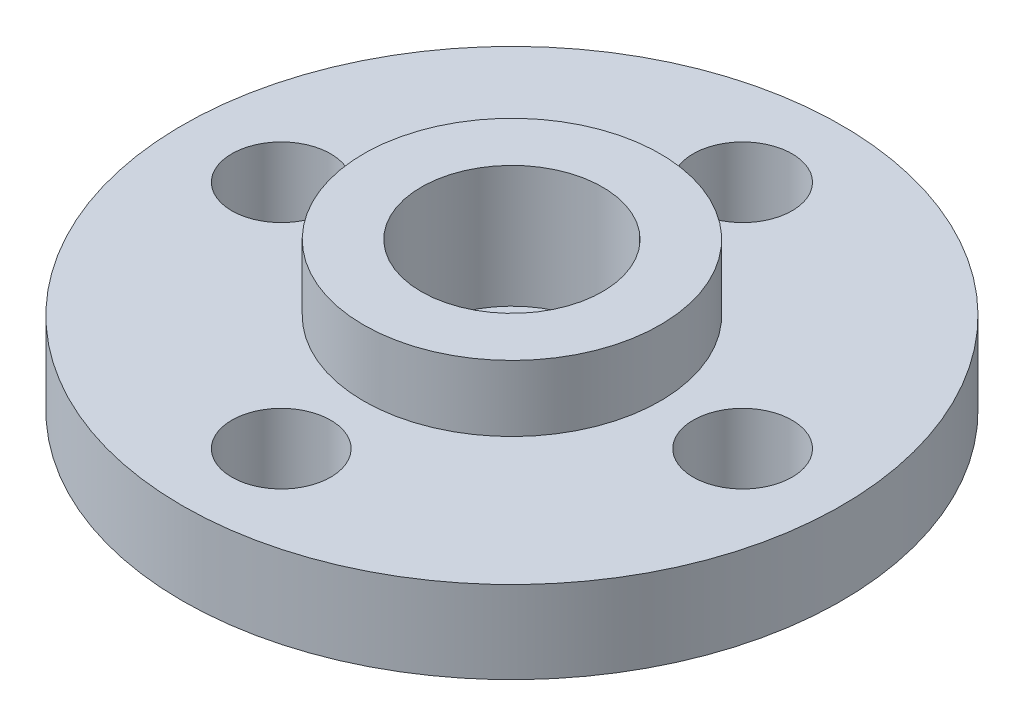
from build123d import *

# Parameters (mm, degrees)
SKETCH1_R           = 10
SKETCH1_R_2         = 1.5
BOSS_EXTRUDE1_DEPTH = 2.5
SKETCH2_R           = 4.5
SKETCH2_R_2         = 1.5
BOSS_EXTRUDE2_DEPTH = 2
SKETCH3_R           = 2.75
CUT_EXTRUDE1_DEPTH  = 3.7


with BuildPart() as part:
    # Sketch1 → Boss-Extrude1 (new body)
    with BuildSketch(Plane(origin=(0, 0, 0), x_dir=(1, 0, 0), z_dir=(0, 1, 0))):
        with Locations(Location((0, 0, 0), (0, 0, 270))):
            Circle(SKETCH1_R)
        with Locations(Location((0, 7, 0), (0, 0, 270))):
            Circle(SKETCH1_R_2, mode=Mode.SUBTRACT)
        with Locations(Location((7, 0, 0), (0, 0, 270))):
            Circle(SKETCH1_R_2, mode=Mode.SUBTRACT)
        with Locations(Location((0, -7, 0), (0, 0, 270))):
            Circle(SKETCH1_R_2, mode=Mode.SUBTRACT)
        with Locations(Location((-7, 0, 0), (0, 0, 270))):
            Circle(SKETCH1_R_2, mode=Mode.SUBTRACT)
        with Locations(Location((0, 0, 0), (0, 0, 270))):
            Circle(SKETCH1_R_2, mode=Mode.SUBTRACT)
    extrude(amount=BOSS_EXTRUDE1_DEPTH)

    # Sketch2 → Boss-Extrude2 (add)
    with BuildSketch(Plane(origin=(0, 2.5, 0), x_dir=(1, 0, 0), z_dir=(0, 1, 0))):
        with Locations(Location((0, 0, 0), (0, 0, 270))):
            Circle(SKETCH2_R)
        with Locations(Location((0, 0, 0), (0, 0, 270))):
            Circle(SKETCH2_R_2, mode=Mode.SUBTRACT)
    extrude(amount=BOSS_EXTRUDE2_DEPTH)

    # Sketch3 → Cut-Extrude1 (cut)
    with BuildSketch(Plane(origin=(0, 4.5, 0), x_dir=(1, 0, 0), z_dir=(0, 1, 0))):
        with Locations(Location((0, 0, 0), (0, 0, 270))):
            Circle(SKETCH3_R)
    extrude(amount=-CUT_EXTRUDE1_DEPTH, mode=Mode.SUBTRACT)


solid = part.part
